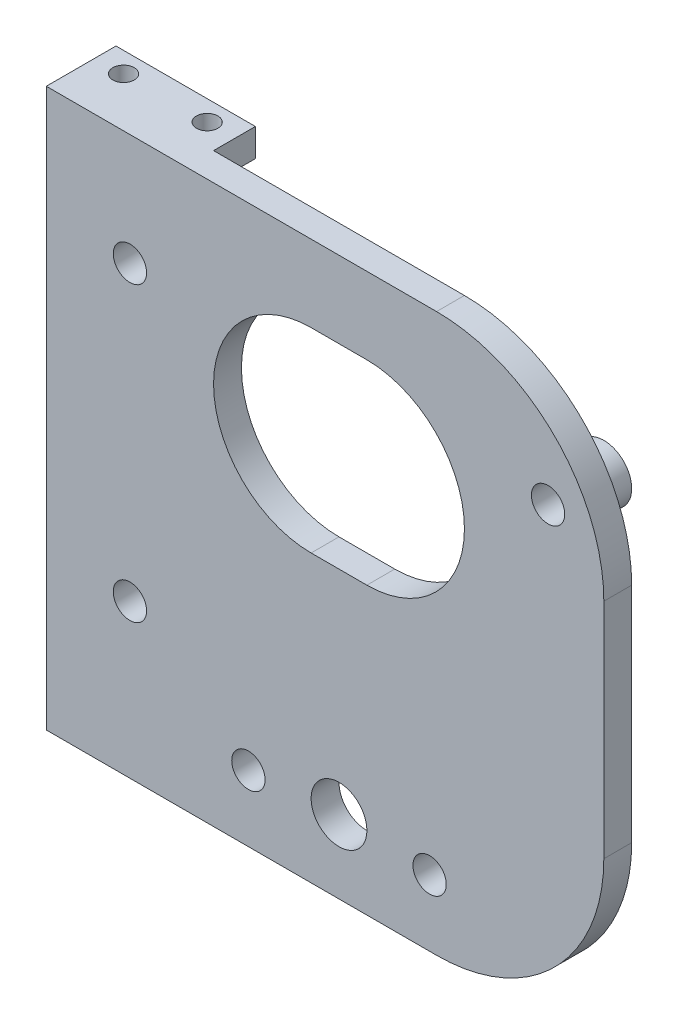
from build123d import *

# Parameters (mm, degrees)
SKETCH1_W             = 63.5
SKETCH1_H             = 63.5
BOSS_EXTRUDE1_DEPTH   = 3.175
BOSS_EXTRUDE2_DEPTH   = 4.7625
F_2_CLEARANCE_HOLE2_D = 2.4384
FILLET1_R             = 19.05
SKETCH7_W             = 15.875
SKETCH7_H             = 3.175
BOSS_EXTRUDE3_DEPTH   = 4.7625
F_2_CLEARANCE_HOLE3_D = 2.4384
BOSS_EXTRUDE4_START   = -3.175
SKETCH10_R            = 3.175
BOSS_EXTRUDE4_DEPTH   = 3.175
F_6_CLEARANCE_HOLE1_D = 3.7973
SKETCH13_R            = 3.175
CUT_EXTRUDE1_DEPTH    = 3.175


with BuildPart() as part:
    # Sketch1 → Boss-Extrude1 (new body)
    with BuildSketch(Plane.XY):
        Rectangle(SKETCH1_W, SKETCH1_H)
    extrude(amount=BOSS_EXTRUDE1_DEPTH)

    # Sketch2 → Boss-Extrude2 (add)
    with BuildSketch(Plane(origin=(0, 0, 0), x_dir=(-1, 0, 0), z_dir=(0, 0, -1))):
        Polygon((15.875, -31.75), (25.4, -31.75), (31.75, -31.75), (31.75, -28.594993487), (25.755751185, -28.594993487), (15.875, -28.594993487), align=None)
    extrude(amount=BOSS_EXTRUDE2_DEPTH)

    # #2 Clearance Hole2 (through all)
    with Locations(Plane(origin=(0, -28.594993487, 0), x_dir=(1, 0, 0), z_dir=(0, 1, 0))):
        with Locations((-28.575, 2.447629477), (-19.05, 2.447629477)):
            Hole(F_2_CLEARANCE_HOLE2_D / 2)

    # Fillet1
    fillet1_edges = [part.edges().sort_by_distance(p)[0] for p in [
        (31.75, -31.75, 1.5875),
        (31.75, 31.75, 1.5875),
    ]]
    fillet(fillet1_edges, radius=FILLET1_R)

    # Sketch7 → Boss-Extrude3 (add)
    with BuildSketch(Plane(origin=(0, 0, 0), x_dir=(-1, 0, 0), z_dir=(0, 0, -1))):
        with Locations((23.8125, 30.1625)):
            Rectangle(SKETCH7_W, SKETCH7_H)
    extrude(amount=BOSS_EXTRUDE3_DEPTH)

    # #2 Clearance Hole3 (through all)
    with Locations(Plane(origin=(0, 31.75, 0), x_dir=(1, 0, 0), z_dir=(0, 1, 0))):
        with Locations((-28.575, 2.447629477), (-19.05, 2.447629477)):
            Hole(F_2_CLEARANCE_HOLE3_D / 2)

    # Sketch10 → Boss-Extrude4 (add)
    with BuildSketch(Plane.XY.offset(3.175).offset(BOSS_EXTRUDE4_START)):
        with Locations((25.4, 19.05)):
            Circle(SKETCH10_R)
        with Locations((-22.225, 19.05)):
            Circle(SKETCH10_R)
        with Locations((-22.225, -14.2875)):
            Circle(SKETCH10_R)
        with Locations((-8.73125, -24.209375)):
            Circle(SKETCH10_R)
        with Locations((11.90625, -24.209375)):
            Circle(SKETCH10_R)
    extrude(amount=-BOSS_EXTRUDE4_DEPTH)

    # #6 Clearance Hole1 (through all)
    with Locations(Plane(origin=(0, 0, -3.175), x_dir=(-1, 0, 0), z_dir=(0, 0, -1))):
        with Locations((-25.4, 19.05), (22.225, 19.05), (22.225, -14.2875), (8.73125, -24.209375), (-11.90625, -24.209375)):
            Hole(F_6_CLEARANCE_HOLE1_D / 2)

    # Sketch13 → Cut-Extrude1 (cut)
    with BuildSketch(Plane.XY.offset(3.175)):
        with Locations((1.5875, -23.415625)):
            Circle(SKETCH13_R)
        with BuildLine():
            Line((-1.5875, 23.01875), (4.7625, 23.01875))
            ThreePointArc((4.7625, 23.01875), (15.875, 11.90625), (4.7625, 0.79375))
            Line((4.7625, 0.79375), (-1.5875, 0.79375))
            ThreePointArc((-1.5875, 0.79375), (-12.7, 11.90625), (-1.5875, 23.01875))
        make_face()
    extrude(amount=-CUT_EXTRUDE1_DEPTH, mode=Mode.SUBTRACT)


solid = part.part
